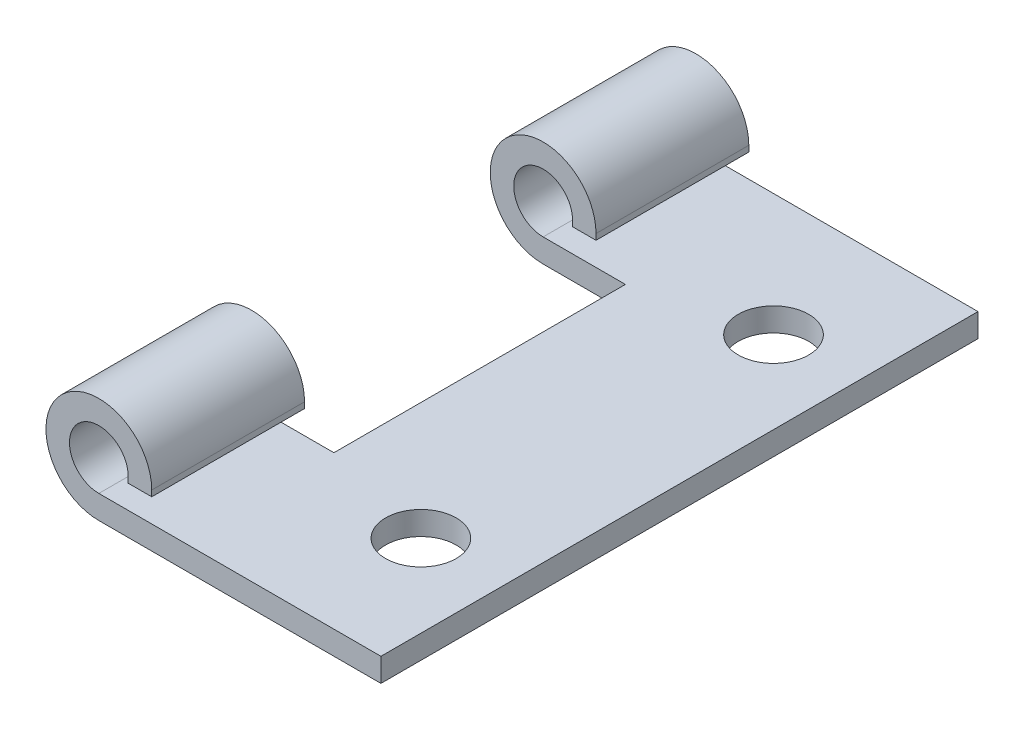
from build123d import *

# Parameters (mm, degrees)
SALIENTE_EXTRUIR1_DEPTH = 25.4
CROQUIS4_R              = 1.5
CROQUIS4_W              = 5.75
CROQUIS4_H              = 12.4
CORTAR_EXTRUIR3_DEPTH   = 29.45013181


with BuildPart() as part:
    # Croquis1 → Saliente-Extruir1 (new body)
    with BuildSketch(Plane.XY):
        with BuildLine():
            Line((0, -2.25), (12, -2.25))
            Line((12, -2.25), (12, -1.25))
            Line((12, -1.25), (1.870828693, -1.25))
            Line((1.870828693, -1.25), (0, -1.25))
            ThreePointArc((0, -1.25), (-0.883883476, 0.883883476), (1.25, 0))
            Line((1.25, 0), (1.25, -0.25))
            Line((1.25, -0.25), (2.236067977, -0.25))
            Line((2.236067977, -0.25), (2.25, -0.25))
            Line((2.25, -0.25), (2.25, 0))
            ThreePointArc((2.25, 0), (-1.590990258, 1.590990258), (0, -2.25))
        make_face()
    extrude(amount=SALIENTE_EXTRUIR1_DEPTH)

    # Croquis4 → Cortar-Extruir3 (cut, through all)
    with BuildSketch(Plane.XZ.offset(2.25)):
        with Locations(Location((8.5, 20.2, 0), (0, 0, 270))):
            Circle(CROQUIS4_R)
        with Locations(Location((8.5, 5.2, 0), (0, 0, 270))):
            Circle(CROQUIS4_R)
        with Locations((0.625, 12.7)):
            Rectangle(CROQUIS4_W, CROQUIS4_H)
    extrude(amount=-CORTAR_EXTRUIR3_DEPTH, mode=Mode.SUBTRACT)


solid = part.part
